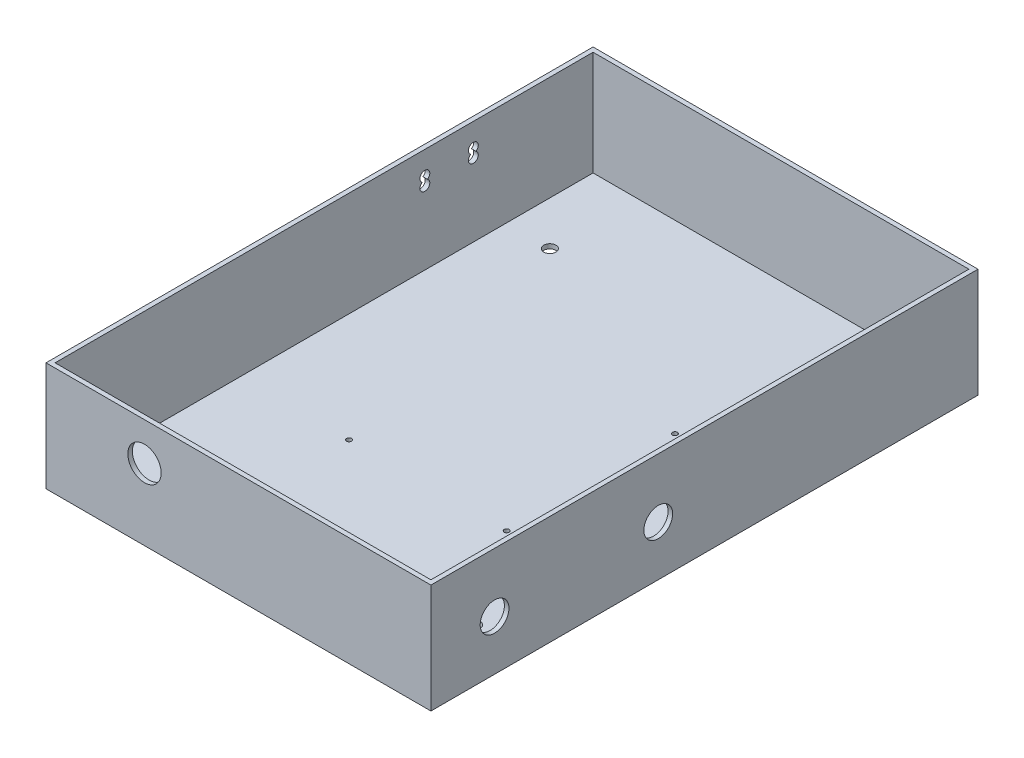
from build123d import *

# Parameters (mm, degrees)
SKETCH1_W             = 254
SKETCH1_H             = 361
SKETCH1_W_2           = 248
SKETCH1_H_2           = 355
BOSS_EXTRUDE1_DEPTH   = 3
BOSS_EXTRUDE2_START   = 3
SKETCH1_3_W           = 254
SKETCH1_3_H           = 361
SKETCH1_3_W_2         = 248
SKETCH1_3_H_2         = 355
BOSS_EXTRUDE2_DEPTH   = 69
SKETCH2_R             = 9.5
CUT_EXTRUDE1_DEPTH    = 3
SKETCH3_R             = 11
CUT_EXTRUDE2_DEPTH    = 3
SKETCH4_R             = 3.25
CUT_EXTRUDE3_DEPTH    = 3
SKETCH5_R             = 4
CUT_EXTRUDE4_DEPTH    = 3
M4X0_7_TAPPED_HOLE1_D = 3.3


with BuildPart() as part:
    # Sketch1 → Boss-Extrude1 (new body)
    # profile 1 of 2: a face of its own
    with BuildSketch(Plane(origin=(0, 0, 0), x_dir=(1, 0, 0), z_dir=(0, 1, 0))):
        with Locations((124, -177.5)):
            Rectangle(SKETCH1_W, SKETCH1_H)
        with Locations((124, -177.5)):
            Rectangle(SKETCH1_W_2, SKETCH1_H_2, mode=Mode.SUBTRACT)
    # profile 2 of 2: a face of its own
    with BuildSketch(Plane(origin=(0, 0, 0), x_dir=(1, 0, 0), z_dir=(0, 1, 0))):
        with Locations((124, -177.5)):
            Rectangle(SKETCH1_W_2, SKETCH1_H_2)
    extrude(amount=BOSS_EXTRUDE1_DEPTH)

    # Sketch1<3> → Boss-Extrude2 (add)
    with BuildSketch(Plane(origin=(0, 0, 0), x_dir=(1, 0, 0), z_dir=(0, 1, 0)).offset(BOSS_EXTRUDE2_START)):
        with Locations((124, -177.5)):
            Rectangle(SKETCH1_3_W, SKETCH1_3_H)
        with Locations((124, -177.5)):
            Rectangle(SKETCH1_3_W_2, SKETCH1_3_H_2, mode=Mode.SUBTRACT)
    extrude(amount=BOSS_EXTRUDE2_DEPTH)

    # Sketch2 → Cut-Extrude1 (cut)
    with BuildSketch(Plane(origin=(251, 0, 0), x_dir=(0, 0, -1), z_dir=(1, 0, 0))):
        with Locations((-316, 33)):
            Circle(SKETCH2_R)
        with Locations((-208, 33)):
            Circle(SKETCH2_R)
    extrude(amount=-CUT_EXTRUDE1_DEPTH, mode=Mode.SUBTRACT)

    # Sketch3 → Cut-Extrude2 (cut)
    with BuildSketch(Plane.XY.offset(358)):
        with Locations((62, 47)):
            Circle(SKETCH3_R)
    extrude(amount=-CUT_EXTRUDE2_DEPTH, mode=Mode.SUBTRACT)

    # Sketch4 → Cut-Extrude3 (cut)
    with BuildSketch(Plane.ZY.offset(3)):
        with Locations((79, 51.25)):
            Circle(SKETCH4_R)
        with Locations((79, 56.75)):
            Circle(SKETCH4_R)
        with Locations((111, 56.75)):
            Circle(SKETCH4_R)
        with Locations((111, 51.25)):
            Circle(SKETCH4_R)
    extrude(amount=-CUT_EXTRUDE3_DEPTH, mode=Mode.SUBTRACT)

    # Sketch5 → Cut-Extrude4 (cut)
    with BuildSketch(Plane(origin=(0, 3, 0), x_dir=(1, 0, 0), z_dir=(0, 1, 0))):
        with Locations(Location((29, -297.5, 0), (0, 0, 270))):
            Circle(SKETCH5_R)
        with Locations(Location((219, -297.5, 0), (0, 0, 270))):
            Circle(SKETCH5_R)
        with Locations(Location((29, -57.5, 0), (0, 0, 270))):
            Circle(SKETCH5_R)
        with Locations(Location((219, -57.5, 0), (0, 0, 270))):
            Circle(SKETCH5_R)
    extrude(amount=-CUT_EXTRUDE4_DEPTH, mode=Mode.SUBTRACT)

    # M4x0.7 Tapped Hole1 (through all)
    with Locations(Plane(origin=(0, 3, 0), x_dir=(1, 0, 0), z_dir=(0, 1, 0))):
        with Locations((72, -233), (176, -233), (176, -122)):
            Hole(M4X0_7_TAPPED_HOLE1_D / 2)


solid = part.part
